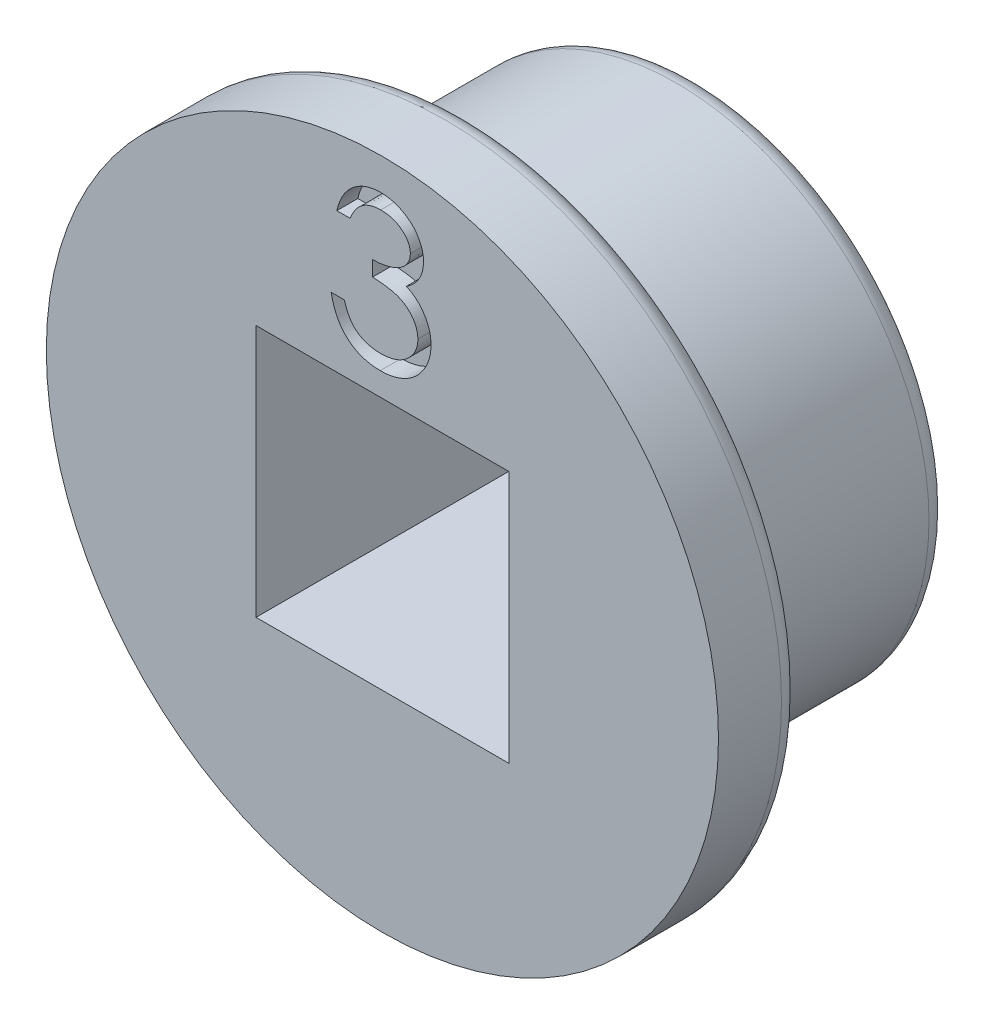
from build123d import *

# Parameters (mm, degrees)
SKETCH1_R           = 6.011
SKETCH1_W           = 6.016
SKETCH1_H           = 6.016
BOSS_EXTRUDE1_DEPTH = 5.5
SKETCH1_3_R         = 8
SKETCH1_3_W         = 6.016
SKETCH1_3_H         = 6.016
BOSS_EXTRUDE2_DEPTH = 2
FILLET1_R           = 0.5
CUT_EXTRUDE1_DEPTH  = 0.5


with BuildPart() as part:
    # Sketch1 → Boss-Extrude1 (new body)
    with BuildSketch(Plane.XY):
        Circle(SKETCH1_R)
        Rectangle(SKETCH1_W, SKETCH1_H, mode=Mode.SUBTRACT)
    extrude(amount=-BOSS_EXTRUDE1_DEPTH)

    # Sketch1<3> → Boss-Extrude2 (add)
    with BuildSketch(Plane.XY):
        Circle(SKETCH1_3_R)
        Rectangle(SKETCH1_3_W, SKETCH1_3_H, mode=Mode.SUBTRACT)
    extrude(amount=BOSS_EXTRUDE2_DEPTH)

    # Fillet1
    fillet1_edges = [part.edges().sort_by_distance(p)[0] for p in [
        (-8, 0, 0),
        (-6.011, 0, -5.5),
    ]]
    fillet(fillet1_edges, radius=FILLET1_R)

    # Sketch2 → Cut-Extrude1 (cut)
    with BuildSketch(Plane.XY.offset(2)):
        with BuildLine():
            Line((-0.770976701, 6.337168177), (-1.085079266, 6.337168177))
            add(Edge.make_bspline(
                [(-1.085079266, 6.337168177), (-1.076569715, 6.372400661), (-1.059934239, 6.441277286), (-1.025236666, 6.539684546), (-0.987437411, 6.632808068), (-0.942048306, 6.718904141), (-0.892539552, 6.799703044), (-0.83581683, 6.873372169), (-0.774497108, 6.941785134), (-0.706672158, 7.002498372), (-0.635543497, 7.057476101), (-0.560108877, 7.104351158), (-0.481885983, 7.144675311), (-0.40033285, 7.177895543), (-0.315206679, 7.202921067), (-0.227277055, 7.221077872), (-0.136313555, 7.232868986), (-0.074565965, 7.23401975), (-0.043212278, 7.234604075)],
                knots=[0, 0, 0, 0, 1.162005537, 2.271625781, 3.343758855, 4.383309926, 5.390229558, 6.379919256, 7.361854164, 8.333198761, 9.295911338, 10.242430842, 11.177959212, 12.116337295, 13.062827104, 14.020064771, 14.994644689, 16, 16, 16, 16], degree=3))
            add(Edge.make_bspline(
                [(-0.043212278, 7.234604075), (0.002470464, 7.233224844), (0.092839475, 7.230496469), (0.225602522, 7.205582032), (0.353629341, 7.1661569), (0.475518589, 7.111683173), (0.588737021, 7.04449586), (0.689473208, 6.964531123), (0.776361719, 6.873331821), (0.849256096, 6.772599257), (0.906331095, 6.664943748), (0.948417469, 6.554143591), (0.97403915, 6.440461619), (0.977359707, 6.36370434), (0.979023299, 6.325249107)],
                knots=[0, 0, 0, 0, 1.083050992, 2.142477498, 3.193116406, 4.255571735, 5.30263384, 6.308962982, 7.297363603, 8.282367274, 9.249857812, 10.179914175, 11.08814088, 12, 12, 12, 12], degree=3))
            add(Edge.make_bspline(
                [(0.979023299, 6.325249107), (0.977859708, 6.288242312), (0.97558274, 6.215825757), (0.956249035, 6.11010426), (0.923712772, 6.01046266), (0.878643009, 5.916481498), (0.820301459, 5.828756658), (0.749628762, 5.747090767), (0.6661261, 5.671121609), (0.602847162, 5.627602136), (0.570269292, 5.605197023)],
                knots=[0, 0, 0, 0, 1.024540389, 2.004866551, 2.965041327, 3.920577974, 4.882998113, 5.874504559, 6.905732034, 8, 8, 8, 8], degree=3))
            add(Edge.make_bspline(
                [(0.570269292, 5.605197023), (0.607501047, 5.587218852), (0.681267921, 5.551598894), (0.781818451, 5.481743137), (0.873096326, 5.401086789), (0.924000045, 5.338144136), (0.949576183, 5.306519139)],
                knots=[0, 0, 0, 0, 1.015518401, 2.012035669, 3.001164323, 4, 4, 4, 4], degree=3))
            add(Edge.make_bspline(
                [(0.949576183, 5.306519139), (0.966417526, 5.283461387), (0.999824422, 5.237723471), (1.041059955, 5.164187045), (1.07846907, 5.089835555), (1.107619289, 5.012676149), (1.130193156, 4.933603136), (1.146329188, 4.85248074), (1.156353329, 4.769242717), (1.157788881, 4.712930237), (1.158510478, 4.684624107)],
                knots=[0, 0, 0, 0, 1.025084078, 2.033381695, 3.024893161, 4.013698104, 4.991890475, 5.976764909, 6.982997093, 8, 8, 8, 8], degree=3))
            add(Edge.make_bspline(
                [(1.158510478, 4.684624107), (1.156715965, 4.635614385), (1.153135383, 4.537825584), (1.121131308, 4.393350862), (1.071518068, 4.25212536), (1.001061132, 4.11705052), (0.915193623, 3.990670139), (0.813036299, 3.87759383), (0.69574989, 3.780395226), (0.564944241, 3.699184998), (0.423227113, 3.634267076), (0.271651521, 3.589209633), (0.112401467, 3.559863633), (0.003194169, 3.556716764), (-0.052326862, 3.555116895)],
                knots=[0, 0, 0, 0, 0.955779014, 1.907060117, 2.875433937, 3.871313158, 4.872415639, 5.851225146, 6.836215519, 7.83643374, 8.849228613, 9.86973379, 10.916971861, 12, 12, 12, 12], degree=3))
            add(Edge.make_bspline(
                [(-0.052326862, 3.555116895), (-0.089746162, 3.555985108), (-0.163374867, 3.557693463), (-0.271618365, 3.569372064), (-0.374940065, 3.590702069), (-0.473479663, 3.619405374), (-0.567324699, 3.655797116), (-0.656188804, 3.701115814), (-0.740618698, 3.754427316), (-0.819817649, 3.816360904), (-0.893776217, 3.885642244), (-0.960528941, 3.963501254), (-1.021188734, 4.048498658), (-1.074131372, 4.141621714), (-1.121768325, 4.241666971), (-1.160949282, 4.34991547), (-1.19543485, 4.465399492), (-1.211468315, 4.545877232), (-1.21969465, 4.587168177)],
                knots=[0, 0, 0, 0, 1.048658725, 2.063410685, 3.046034179, 4.001477787, 4.936774919, 5.862367409, 6.792675028, 7.730719943, 8.675894397, 9.627829632, 10.600096036, 11.597688215, 12.626045268, 13.701542398, 14.82072376, 16, 16, 16, 16], degree=3))
            Line((-1.21969465, 4.587168177), (-0.905592086, 4.587168177))
            add(Edge.make_bspline(
                [(-0.905592086, 4.587168177), (-0.897408795, 4.560219164), (-0.881491582, 4.507800992), (-0.854397284, 4.432360687), (-0.823529012, 4.363202633), (-0.790414453, 4.299819511), (-0.755636007, 4.241587109), (-0.716721082, 4.19004524), (-0.676551937, 4.142930038), (-0.646272584, 4.116385426), (-0.631453464, 4.103394139)],
                knots=[0, 0, 0, 0, 1.198163088, 2.33053128, 3.407730985, 4.417276592, 5.372219308, 6.28897303, 7.162600585, 8, 8, 8, 8], degree=3))
            add(Edge.make_bspline(
                [(-0.631453464, 4.103394139), (-0.611856888, 4.088285805), (-0.572724225, 4.058115773), (-0.508955994, 4.019614144), (-0.441891108, 3.986253119), (-0.370076433, 3.960769423), (-0.295061663, 3.939191763), (-0.215634298, 3.925071244), (-0.132495081, 3.915383072), (-0.075727317, 3.914528141), (-0.046717887, 3.914091254)],
                knots=[0, 0, 0, 0, 0.946170439, 1.889420265, 2.845303464, 3.807233317, 4.801018734, 5.828864929, 6.890507805, 8, 8, 8, 8], degree=3))
            add(Edge.make_bspline(
                [(-0.046717887, 3.914091254), (-0.013964385, 3.914707159), (0.050082262, 3.915911509), (0.143537122, 3.926987216), (0.232444569, 3.943117629), (0.315817495, 3.968030612), (0.394748002, 3.998811463), (0.468129652, 4.037459869), (0.536925758, 4.082804591), (0.600255164, 4.134343749), (0.657200671, 4.190765244), (0.707340184, 4.249778315), (0.749964846, 4.311134145), (0.784348424, 4.375172266), (0.811498974, 4.441627495), (0.829982175, 4.510686324), (0.84283369, 4.58178359), (0.843880302, 4.630112559), (0.844407914, 4.654475869)],
                knots=[0, 0, 0, 0, 1.217147791, 2.380027433, 3.494444702, 4.572153297, 5.609568379, 6.639424714, 7.649109417, 8.668170816, 9.669597737, 10.625200337, 11.543417969, 12.441394052, 13.322311151, 14.205496177, 15.095365482, 16, 16, 16, 16], degree=3))
            add(Edge.make_bspline(
                [(0.844407914, 4.654475869), (0.842877612, 4.687087208), (0.839824624, 4.752147617), (0.816516045, 4.847865191), (0.77817718, 4.940088603), (0.724504669, 5.027244393), (0.65916894, 5.108020295), (0.582804033, 5.180091777), (0.494775805, 5.239561868), (0.413755936, 5.280650525), (0.34199078, 5.3086876), (0.280575395, 5.327362564), (0.211818792, 5.34317622), (0.136552443, 5.357888492), (0.054209226, 5.37040984), (-0.035121212, 5.380851656), (-0.131456973, 5.389206697), (-0.198148139, 5.392937792), (-0.232515163, 5.394860485)],
                knots=[0, 0, 0, 0, 1.07054697, 2.135767047, 3.216561865, 4.33974944, 5.486079747, 6.621378074, 7.775625952, 8.963672916, 9.598146892, 10.304877434, 11.070270905, 11.915000392, 12.823868403, 13.805723172, 14.86925407, 16, 16, 16, 16], degree=3))
            Line((-0.232515163, 5.394860485), (-0.232515163, 5.753834844))
            add(Edge.make_bspline(
                [(-0.232515163, 5.753834844), (-0.189213997, 5.754569648), (-0.104397651, 5.756008948), (0.019496654, 5.773416958), (0.137969966, 5.797497586), (0.248396708, 5.834382778), (0.349045422, 5.877223075), (0.436365024, 5.927075285), (0.509132171, 5.982490034), (0.566993242, 6.044322643), (0.610522471, 6.110637691), (0.642349268, 6.179754348), (0.661149595, 6.252278409), (0.663659262, 6.301773077), (0.664920734, 6.32665135)],
                knots=[0, 0, 0, 0, 1.321986639, 2.589447074, 3.816329219, 5.01088745, 6.139805852, 7.153945165, 8.075214402, 8.924034688, 9.728124013, 10.488707548, 11.240355623, 12, 12, 12, 12], degree=3))
            add(Edge.make_bspline(
                [(0.664920734, 6.32665135), (0.664506324, 6.344929095), (0.663681873, 6.381291802), (0.653284595, 6.434416871), (0.637660554, 6.485917817), (0.616180824, 6.535575627), (0.587430626, 6.583045901), (0.553024639, 6.62873335), (0.512056539, 6.672377129), (0.465111092, 6.713057449), (0.414699287, 6.751826686), (0.359449512, 6.784740323), (0.301027637, 6.812885385), (0.239368982, 6.836094887), (0.174273452, 6.853554175), (0.106046894, 6.866090017), (0.034559211, 6.873927671), (-0.014212521, 6.875056087), (-0.039005548, 6.875629716)],
                knots=[0, 0, 0, 0, 0.884392785, 1.759457502, 2.611959086, 3.489218968, 4.37281399, 5.2945488, 6.255912374, 7.266815255, 8.301784654, 9.332968512, 10.37626691, 11.440494194, 12.520033166, 13.637162961, 14.798855837, 16, 16, 16, 16], degree=3))
            add(Edge.make_bspline(
                [(-0.039005548, 6.875629716), (-0.078857216, 6.874238354), (-0.156696792, 6.8715207), (-0.268911709, 6.847717687), (-0.373231043, 6.809739603), (-0.452969709, 6.764406584), (-0.511852284, 6.71965615), (-0.553929222, 6.680573763), (-0.595249732, 6.63714094), (-0.633095409, 6.586682564), (-0.671369386, 6.532615774), (-0.706213947, 6.472192093), (-0.74007364, 6.406987698), (-0.760476189, 6.360892064), (-0.770976701, 6.337168177)],
                knots=[0, 0, 0, 0, 1.472543308, 2.876219568, 4.221790263, 5.565193594, 6.249813518, 6.953379497, 7.687249741, 8.463570142, 9.283606569, 10.136032583, 11.040678096, 12, 12, 12, 12], degree=3))
        make_face()
    extrude(amount=-CUT_EXTRUDE1_DEPTH, mode=Mode.SUBTRACT)


solid = part.part
